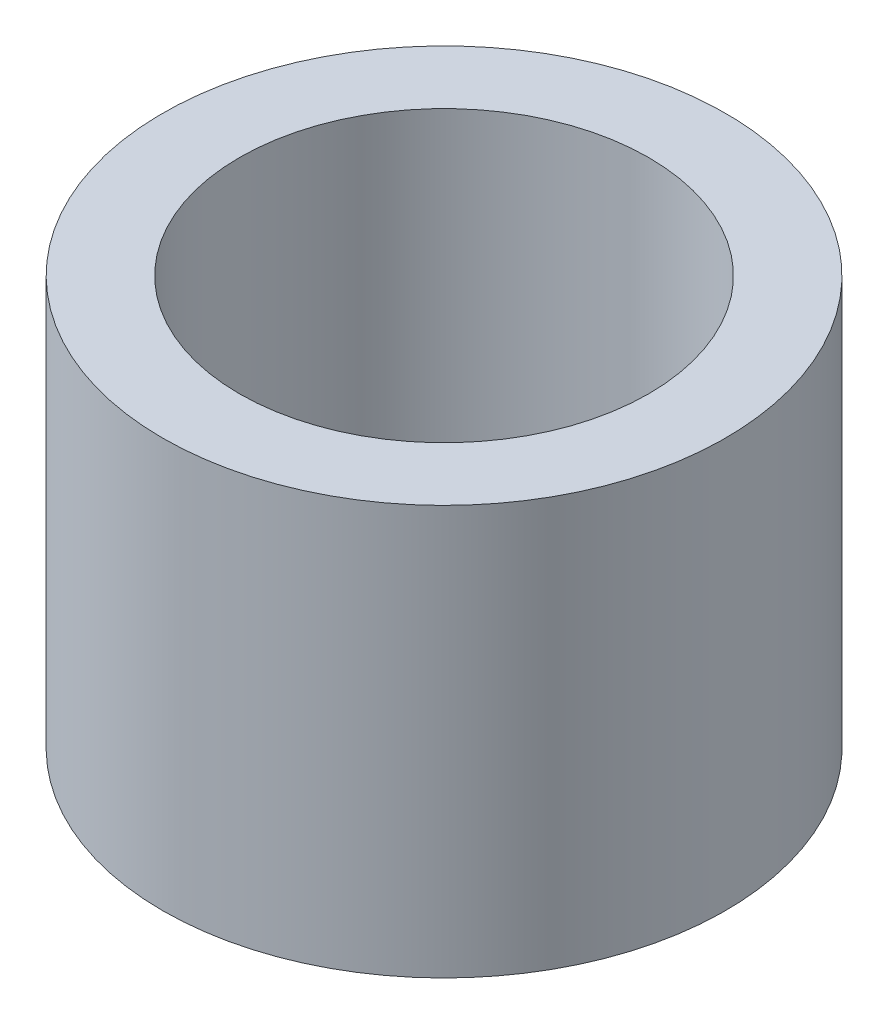
from build123d import *

# Parameters (mm, degrees)
SKETCH1_R           = 5.5
SKETCH1_R_2         = 4
BOSS_EXTRUDE1_DEPTH = 8


with BuildPart() as part:
    # Sketch1 → Boss-Extrude1 (new body)
    with BuildSketch(Plane(origin=(0, 0, 0), x_dir=(1, 0, 0), z_dir=(0, 1, 0))):
        with Locations(Location((0, 0, 0), (0, 0, 270))):
            Circle(SKETCH1_R)
        with Locations(Location((0, 0, 0), (0, 0, 270))):
            Circle(SKETCH1_R_2, mode=Mode.SUBTRACT)
    extrude(amount=BOSS_EXTRUDE1_DEPTH)


solid = part.part
